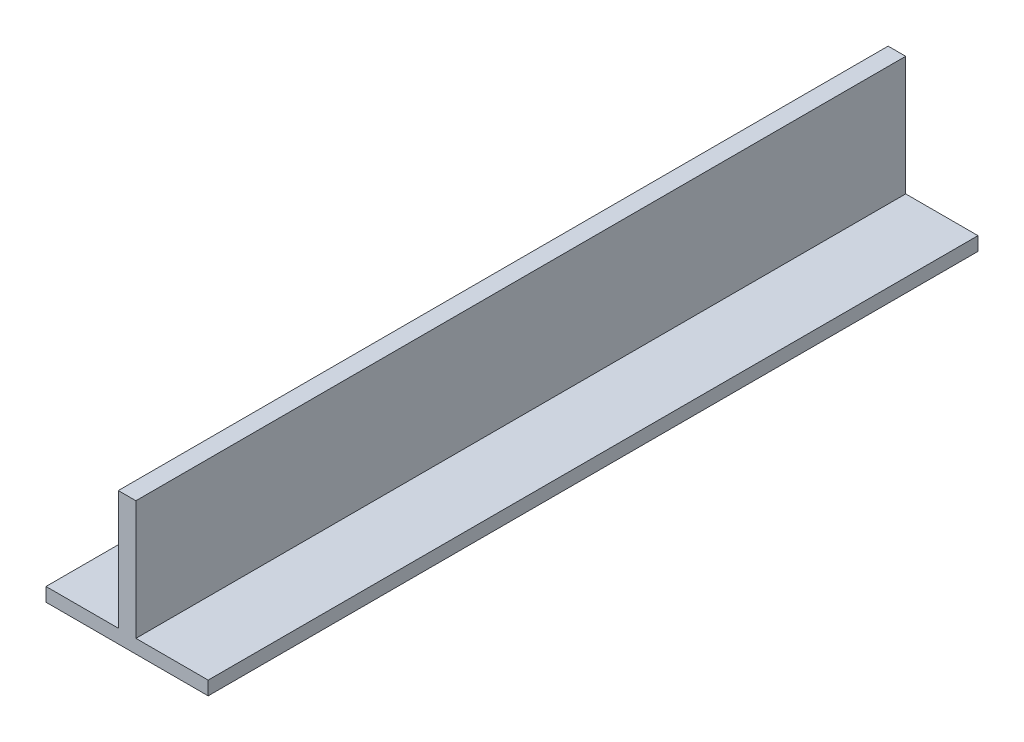
from build123d import *

# Parameters (mm, degrees)
BOSS_EXTRU_1_DEPTH = 394


with BuildPart() as part:
    # Esquisse1 → Boss.-Extru.1 (new body)
    with BuildSketch(Plane.XY):
        Polygon((0, 0), (83, 0), (83, 7), (46, 7), (46, 68), (37, 68), (37, 7), (0, 7), align=None)
    extrude(amount=BOSS_EXTRU_1_DEPTH)


solid = part.part
